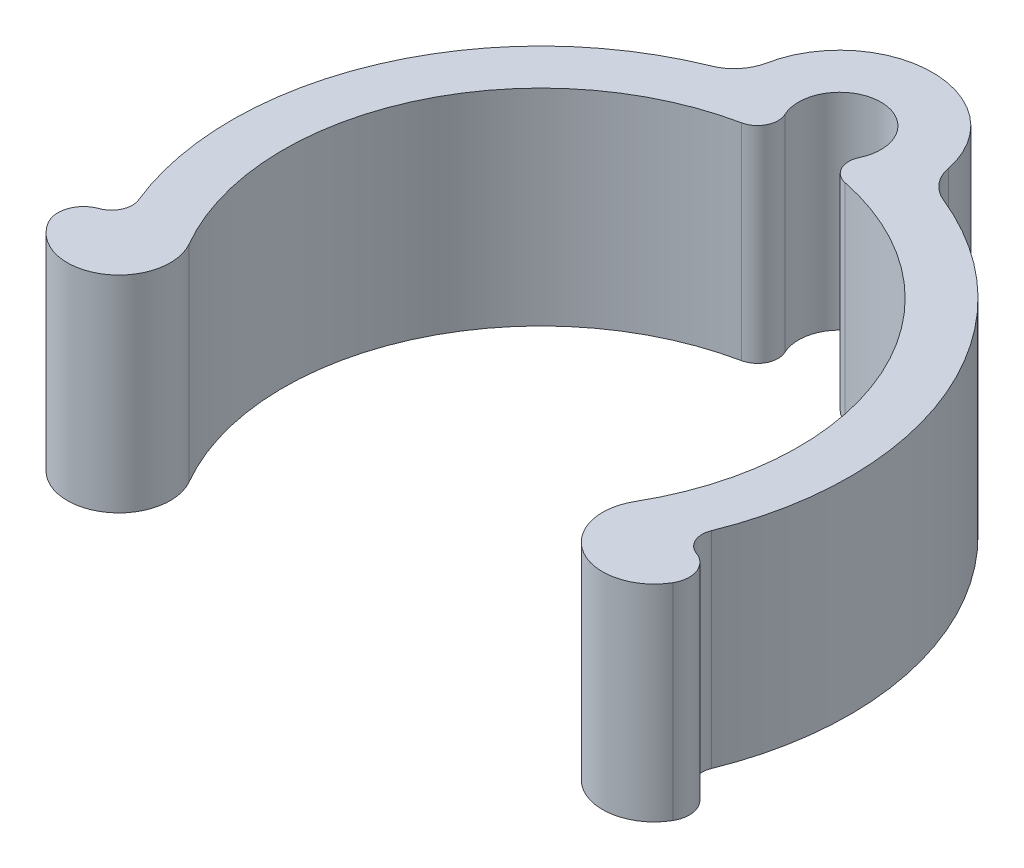
from build123d import *

# Parameters (mm, degrees)
SKETCH2_R               = 10.5
BOSS_EXTRUDE1_DEPTH     = 42
SKETCH3_R               = 12.5
BOSS_EXTRUDE2_DEPTH     = 4
SKETCH4_R               = 2.5
CUT_EXTRUDE1_DEPTH      = 12
CUT_EXTRUDE2_DEPTH      = 6
SKETCH6_R               = 12.5
SKETCH6_R_2             = 3.35
BOSS_EXTRUDE3_DEPTH     = 1
SKETCH8_W               = 3
SKETCH8_H               = 0.5
SKETCH8_W_2             = 0.5
SKETCH8_H_2             = 3
BOSS_EXTRUDE4_DEPTH     = 42
CHAMFER1_SIZE           = 1
CUT_EXTRUDE3_DEPTH      = 51.214539727
CUT_EXTRUDE3_DEPTH_BACK = 51.214539727
SKETCH7_R               = 3.5
BOSS_EXTRUDE11_DEPTH    = 10


with BuildPart() as part:
    # Sketch2 → Boss-Extrude1 (new body)
    with BuildSketch(Plane(origin=(0, 0, 0), x_dir=(1, 0, 0), z_dir=(0, 1, 0))):
        with Locations(Location((0, 0, 0), (0, 0, 90))):
            Circle(SKETCH2_R)
    extrude(amount=BOSS_EXTRUDE1_DEPTH)

    # Sketch3 → Boss-Extrude2 (add)
    with BuildSketch(Plane(origin=(0, 42, 0), x_dir=(1, 0, 0), z_dir=(0, 1, 0))):
        with Locations(Location((0, 0, 0), (0, 0, 270))):
            Circle(SKETCH3_R)
    extrude(amount=BOSS_EXTRUDE2_DEPTH)

    # Sketch4 → Cut-Extrude1 (cut)
    with BuildSketch(Plane(origin=(0, 46, 0), x_dir=(1, 0, 0), z_dir=(0, 1, 0))):
        with Locations(Location((0, 0, 0), (0, 0, 270))):
            Circle(SKETCH4_R)
    extrude(amount=-CUT_EXTRUDE1_DEPTH, mode=Mode.SUBTRACT)

    # Sketch5 → Cut-Extrude2 (cut)
    with BuildSketch(Plane.XZ.offset(-35)):
        Polygon((-4.734272207, 0), (-2.367136104, -4.1), (2.367136104, -4.1), (4.734272207, 0), (2.367136104, 4.1), (-2.367136104, 4.1), align=None)
    extrude(amount=-CUT_EXTRUDE2_DEPTH, mode=Mode.SUBTRACT)

    # Sketch6 → Boss-Extrude3 (add)
    with BuildSketch(Plane(origin=(0, 46, 0), x_dir=(1, 0, 0), z_dir=(0, 1, 0))):
        with Locations(Location((0, 0, 0), (0, 0, 270))):
            Circle(SKETCH6_R)
        with Locations(Location((0, 0, 0), (0, 0, 270))):
            Circle(SKETCH6_R_2, mode=Mode.SUBTRACT)
    extrude(amount=BOSS_EXTRUDE3_DEPTH)

    # Sketch8 → Boss-Extrude4 (add)
    with BuildSketch(Plane.XZ):
        Polygon((6.541030619, 8.662765176), (8.662350963, 6.541444833), (8.308797572, 6.187891442), (6.187477229, 8.309211786), align=None)
        with Locations((0, 10.5)):
            Rectangle(SKETCH8_W, SKETCH8_H)
        with Locations((10.501, 0.001)):
            Rectangle(SKETCH8_W_2, SKETCH8_H_2)
        Polygon((8.663765176, -6.540030619), (6.542444833, -8.661350963), (6.188891442, -8.307797572), (8.310211786, -6.186477229), align=None)
        with Locations((0.002, -10.5)):
            Rectangle(SKETCH8_W, SKETCH8_H)
        Polygon((-6.539030619, -8.662765176), (-8.660350963, -6.541444833), (-8.306797572, -6.187891442), (-6.185477229, -8.309211786), align=None)
        with Locations((-10.499, -0.001)):
            Rectangle(SKETCH8_W_2, SKETCH8_H_2)
        Polygon((-8.661765176, 6.540030619), (-6.540444833, 8.661350963), (-6.186891442, 8.307797572), (-8.308211786, 6.186477229), align=None)
    extrude(amount=-BOSS_EXTRUDE4_DEPTH)

    # Chamfer1
    chamfer1_edges = [part.edges().sort_by_distance(p)[0] for p in [
        (-4.016445773, 0, -9.70145161),
        (-1.498, 0, -10.571296662),
        (0.002, 0, -10.75),
        (1.502, 0, -10.571007987),
        (-9.700211661, 0, -4.019439479),
        (-8.534223693, 0, -6.415317563),
        (-7.599690791, 0, -7.602105005),
        (-6.412729118, 0, -8.536463676),
        (-9.700985019, 0, 4.017572607),
        (-10.570724567, 0, 1.499),
        (-10.749, 0, -0.001),
        (-10.570580229, 0, -1.501),
        (-4.01831274, 0, 9.700678467),
        (-6.414245443, 0, 8.535151573),
        (-7.601105005, 0, 7.600690791),
        (-8.535535893, 0, 6.413801336),
        (4.018039338, 0, 9.700791714),
        (1.5, 0, 10.571152423),
        (0, 0, 10.75),
        (-1.5, 0, 10.571152423),
        (9.700485123, 0, 4.018779463),
        (8.535651573, 0, 6.414745443),
        (7.601690791, 0, 7.602105005),
        (6.414301336, 0, 8.536035893),
        (9.701258362, 0, -4.01691252),
        (10.571724567, 0, -1.499),
        (10.751, 0, 0.001),
        (10.571580229, 0, 1.501),
        (4.019906186, 0, -9.700018261),
        (6.415817563, 0, -8.534723693),
        (7.603105005, 0, -7.600690791),
        (8.536963676, 0, -6.413229118),
    ]]
    chamfer(chamfer1_edges, length=CHAMFER1_SIZE)

    # Sketch7 → Cut-Extrude3 (cut, two sides: drawn at the far end of the back side and taken through both)
    with BuildSketch(Plane(origin=(0, 0, 0), x_dir=(0, 0, -1), z_dir=(1, 0, 0)).offset(-CUT_EXTRUDE3_DEPTH_BACK)):
        with Locations(Location((0, 17, 0), (0, 0, 64.604946599))):
            Circle(SKETCH7_R)
    extrude(amount=CUT_EXTRUDE3_DEPTH + CUT_EXTRUDE3_DEPTH_BACK, mode=Mode.SUBTRACT)


with BuildPart() as body_2:
    # Sketch36 → Boss-Extrude11 (new body)
    with BuildSketch(Plane(origin=(0, 0, 0), x_dir=(1, 0, 0), z_dir=(0, 1, 0))):
        with BuildLine():
            ThreePointArc((10.825317547, -6.25), (11.401622185, 5.123769272), (2.514051045, 12.244572158))
            ThreePointArc((2.514051045, 12.244572158), (1.821132072, 12.77615689), (1.810116753, 13.649425287))
            ThreePointArc((1.810116753, 13.649425287), (0, 16.5), (-1.810116753, 13.649425287))
            ThreePointArc((-1.810116753, 13.649425287), (-1.821132072, 12.77615689), (-2.514051045, 12.244572158))
            ThreePointArc((-2.514051045, 12.244572158), (-11.401622185, 5.123769272), (-10.825317547, -6.25))
            ThreePointArc((-10.825317547, -6.25), (-11.740381057, -9.665063509), (-15.155444566, -8.75))
            ThreePointArc((-15.155444566, -8.75), (-15.246255337, -7.69399267), (-14.493462435, -6.947868736))
            ThreePointArc((-14.493462435, -6.947868736), (-13.917395246, -6.415225062), (-13.903033251, -5.630778491))
            ThreePointArc((-13.903033251, -5.630778491), (-13.811642586, 5.851369845), (-5.626747062, 13.904665314))
            ThreePointArc((-5.626747062, 13.904665314), (-4.835213091, 14.484668262), (-4.41483231, 15.371352785))
            ThreePointArc((-4.41483231, 15.371352785), (0, 19), (4.41483231, 15.371352785))
            ThreePointArc((4.41483231, 15.371352785), (4.835213091, 14.484668262), (5.626747062, 13.904665314))
            ThreePointArc((5.626747062, 13.904665314), (13.811642586, 5.851369845), (13.903033251, -5.630778491))
            ThreePointArc((13.903033251, -5.630778491), (13.917395246, -6.415225062), (14.493462435, -6.947868736))
            ThreePointArc((14.493462435, -6.947868736), (15.246255337, -7.69399267), (15.155444566, -8.75))
            ThreePointArc((15.155444566, -8.75), (11.740381057, -9.665063509), (10.825317547, -6.25))
        make_face()
    extrude(amount=BOSS_EXTRUDE11_DEPTH)


solid = body_2.part
